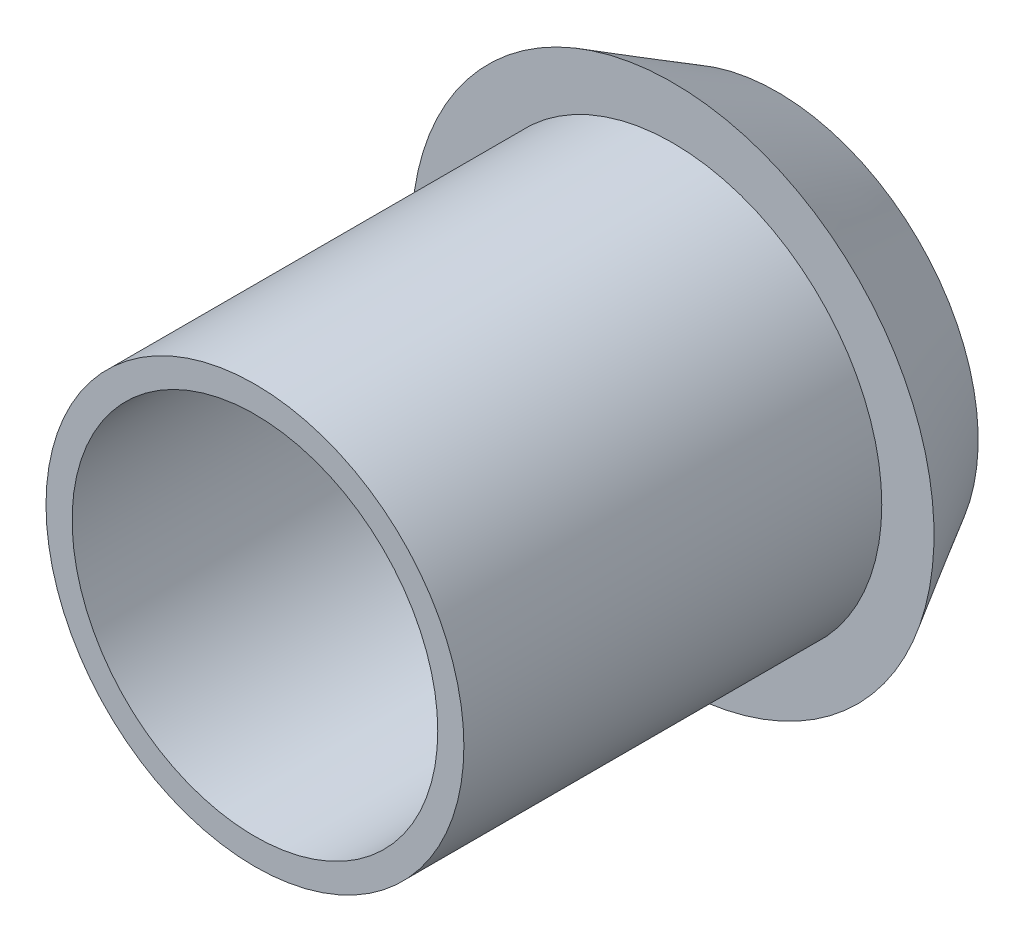
from build123d import *

# Parameters (mm, degrees)
SKETCH2_R           = 4
SKETCH2_R_2         = 3.5
BOSS_EXTRUDE1_DEPTH = 8
SKETCH3_R           = 5
BOSS_EXTRUDE2_DEPTH = 2
BOSS_EXTRUDE2_TAPER = 30


with BuildPart() as part:
    # Sketch2 → Boss-Extrude1 (new body)
    with BuildSketch(Plane.XY):
        Circle(SKETCH2_R)
        Circle(SKETCH2_R_2, mode=Mode.SUBTRACT)
    extrude(amount=BOSS_EXTRUDE1_DEPTH)

    # Sketch3 → Boss-Extrude2 (add)
    with BuildSketch(Plane(origin=(0, 0, 0), x_dir=(-1, 0, 0), z_dir=(0, 0, -1))):
        Circle(SKETCH3_R)
    extrude(amount=BOSS_EXTRUDE2_DEPTH, taper=BOSS_EXTRUDE2_TAPER)


solid = part.part
